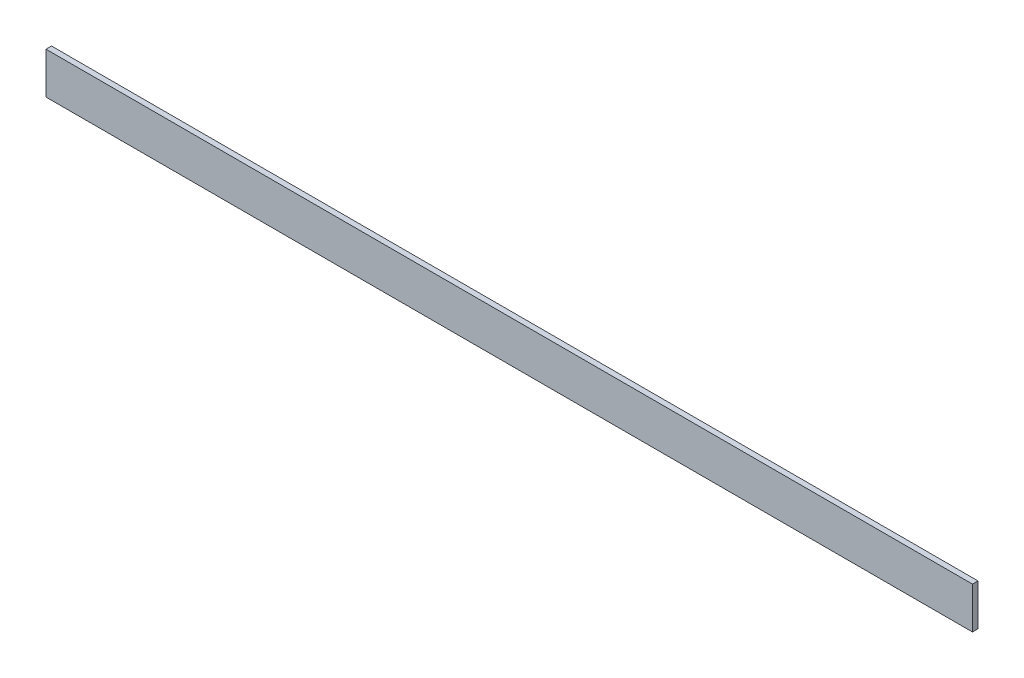
from build123d import *

# Parameters (mm, degrees)
SKETCH1_W           = 670
SKETCH1_H           = 30
BOSS_EXTRUDE1_DEPTH = 4


with BuildPart() as part:
    # Sketch1 → Boss-Extrude1 (new body)
    with BuildSketch(Plane.XY):
        Rectangle(SKETCH1_W, SKETCH1_H)
    extrude(amount=BOSS_EXTRUDE1_DEPTH)


solid = part.part
